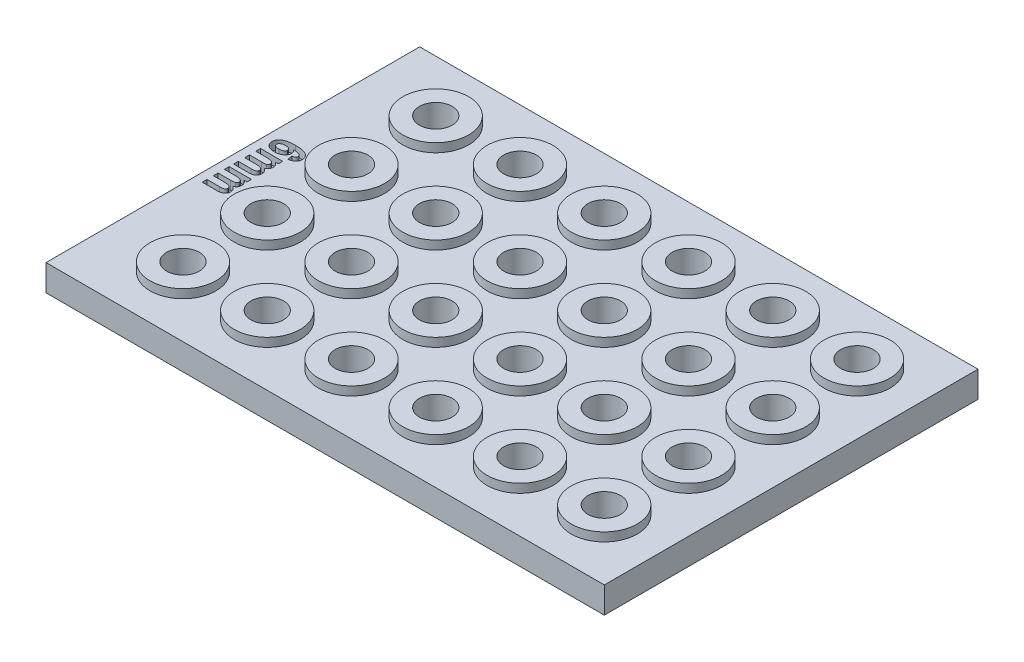
from build123d import *

# Parameters (mm, degrees)
SKETCH1_W            = 127.89
SKETCH1_H            = 85.6
MAIN_PLATE_DEPTH     = 6
WELLS_LSP_R          = 7.56
BOSS_EXTRUDE1_DEPTH  = 2
SKETCH2_W            = 3.75
SKETCH2_H            = 23.5
LPATTERN1_COUNT      = 4
LPATTERN1_PITCH      = 19.3
LPATTERN1_COUNT_DIR2 = 6
LPATTERN1_PITCH_DIR2 = 19.3
CUT_EXTRUDE1_DEPTH   = 2


with BuildPart() as part:
    # Sketch1 → Main Plate (new body)
    with BuildSketch(Plane(origin=(0, 0, 0), x_dir=(1, 0, 0), z_dir=(0, 1, 0))):
        Rectangle(SKETCH1_W, SKETCH1_H)
    extrude(amount=MAIN_PLATE_DEPTH)

    # Wells_LSP → Boss-Extrude1 (add)
    with BuildSketch(Plane(origin=(0, 6, 0), x_dir=(1, 0, 0), z_dir=(0, 1, 0))):
        with Locations(Location((-46.425, 28.96, 0), (0, 0, 270))):
            Circle(WELLS_LSP_R)
        with Locations(Location((-27.125, 28.96, 0), (0, 0, 270))):
            Circle(WELLS_LSP_R)
        with Locations(Location((-7.825, 28.96, 0), (0, 0, 270))):
            Circle(WELLS_LSP_R)
        with Locations(Location((11.475, 28.96, 0), (0, 0, 270))):
            Circle(WELLS_LSP_R)
        with Locations(Location((30.775, 28.96, 0), (0, 0, 270))):
            Circle(WELLS_LSP_R)
        with Locations(Location((50.075, 28.96, 0), (0, 0, 270))):
            Circle(WELLS_LSP_R)
        with Locations(Location((-27.125, 9.66, 0), (0, 0, 270))):
            Circle(WELLS_LSP_R)
        with Locations(Location((-7.825, 9.66, 0), (0, 0, 270))):
            Circle(WELLS_LSP_R)
        with Locations(Location((11.475, 9.66, 0), (0, 0, 270))):
            Circle(WELLS_LSP_R)
        with Locations(Location((30.775, 9.66, 0), (0, 0, 270))):
            Circle(WELLS_LSP_R)
        with Locations(Location((50.075, 9.66, 0), (0, 0, 270))):
            Circle(WELLS_LSP_R)
        with Locations(Location((-27.125, -9.64, 0), (0, 0, 270))):
            Circle(WELLS_LSP_R)
        with Locations(Location((-7.825, -9.64, 0), (0, 0, 270))):
            Circle(WELLS_LSP_R)
        with Locations(Location((11.475, -9.64, 0), (0, 0, 270))):
            Circle(WELLS_LSP_R)
        with Locations(Location((30.775, -9.64, 0), (0, 0, 270))):
            Circle(WELLS_LSP_R)
        with Locations(Location((50.075, -9.64, 0), (0, 0, 270))):
            Circle(WELLS_LSP_R)
        with Locations(Location((-27.125, -28.94, 0), (0, 0, 270))):
            Circle(WELLS_LSP_R)
        with Locations(Location((-7.825, -28.94, 0), (0, 0, 270))):
            Circle(WELLS_LSP_R)
        with Locations(Location((11.475, -28.94, 0), (0, 0, 270))):
            Circle(WELLS_LSP_R)
        with Locations(Location((30.775, -28.94, 0), (0, 0, 270))):
            Circle(WELLS_LSP_R)
        with Locations(Location((50.075, -28.94, 0), (0, 0, 270))):
            Circle(WELLS_LSP_R)
        with Locations(Location((-46.425, 9.66, 0), (0, 0, 270))):
            Circle(WELLS_LSP_R)
        with Locations(Location((-46.425, -9.64, 0), (0, 0, 270))):
            Circle(WELLS_LSP_R)
        with Locations(Location((-46.425, -28.94, 0), (0, 0, 270))):
            Circle(WELLS_LSP_R)
    extrude(amount=BOSS_EXTRUDE1_DEPTH)

    # Sketch2 → Cut-Revolve1 (revolve, cut)
    with BuildSketch(Plane(origin=(0, 0, -28.96), x_dir=(-1, 0, 0), z_dir=(0, 0, -1)), mode=Mode.PRIVATE) as cut_revolve1_sk:
        with Locations((48.3, 11.75)):
            Rectangle(SKETCH2_W, SKETCH2_H)
    cut_revolve1 = revolve(cut_revolve1_sk.sketch.rotate(Axis((-46.425, 23.5, -28.96), (0, -1, 0)), 270), axis=Axis((-46.425, 23.5, -28.96), (0, -1, 0)), mode=Mode.SUBTRACT)

    # LPattern1: Cut-Revolve1 4 × 6
    with Locations(*[(j * LPATTERN1_PITCH_DIR2, 0, i * LPATTERN1_PITCH) for i in range(LPATTERN1_COUNT) for j in range(LPATTERN1_COUNT_DIR2) if (i, j) != (0, 0)]):
        add(cut_revolve1, mode=Mode.SUBTRACT)

    # Sketch3 → Cut-Extrude1 (cut)
    # profile 1 of 3: a face of its own
    with BuildSketch(Plane(origin=(0, 6, 0), x_dir=(1, 0, 0), z_dir=(0, 1, 0))):
        with BuildLine():
            Line((-56.731072257, 5.409090909), (-56.912890439, 6.5))
            add(Edge.make_bspline(
                [(-56.912890439, 6.5), (-56.848754865, 6.507160681), (-56.72796693, 6.520646549), (-56.56047781, 6.560192719), (-56.417656996, 6.613160299), (-56.300493906, 6.681573851), (-56.206765303, 6.763700377), (-56.141754586, 6.862980945), (-56.100987931, 6.976613067), (-56.096857287, 7.057405463), (-56.094708621, 7.099431818)],
                knots=[0, 0, 0, 0, 1.373534822, 2.586808301, 3.656255023, 4.605807111, 5.462623692, 6.284975384, 7.107883449, 8, 8, 8, 8], degree=3))
            add(Edge.make_bspline(
                [(-56.094708621, 7.099431818), (-56.095617152, 7.127486244), (-56.097408923, 7.18281407), (-56.117301088, 7.263553824), (-56.147140948, 7.34126874), (-56.189734876, 7.415524739), (-56.246836807, 7.483977735), (-56.314059868, 7.549523281), (-56.392663465, 7.612385605), (-56.485461687, 7.67187712), (-56.597314698, 7.726246312), (-56.731646277, 7.776225511), (-56.891730839, 7.816390269), (-57.075059429, 7.857623835), (-57.284612512, 7.888333403), (-57.518502347, 7.917051654), (-57.77720298, 7.939497691), (-57.957838828, 7.949385812), (-58.052094984, 7.954545455)],
                knots=[0, 0, 0, 0, 0.576990169, 1.137917149, 1.703239646, 2.288990578, 2.892433666, 3.534106501, 4.221341408, 4.962944926, 5.800749476, 6.77943051, 7.910748907, 9.198722595, 10.650465757, 12.272170328, 14.054810806, 16, 16, 16, 16], degree=3))
            add(Edge.make_bspline(
                [(-58.052094984, 7.954545455), (-58.005002948, 7.920874283), (-57.913712886, 7.855601181), (-57.792238573, 7.746000091), (-57.690442226, 7.629665314), (-57.605547706, 7.508702989), (-57.53924654, 7.38081576), (-57.491647259, 7.246163833), (-57.464674452, 7.104288993), (-57.460471498, 7.007684503), (-57.458344984, 6.958806818)],
                knots=[0, 0, 0, 0, 1.147521788, 2.224523334, 3.235995272, 4.207625523, 5.148408325, 6.08392744, 7.030550333, 8, 8, 8, 8], degree=3))
            add(Edge.make_bspline(
                [(-57.458344984, 6.958806818), (-57.460412211, 6.904728745), (-57.464520831, 6.797248392), (-57.492697332, 6.638696267), (-57.544105098, 6.486681662), (-57.612453787, 6.33899984), (-57.701451843, 6.197023992), (-57.808644904, 6.059093953), (-57.937669904, 5.929151752), (-58.083234605, 5.804786957), (-58.24429731, 5.689401328), (-58.420957602, 5.590451057), (-58.609933186, 5.506547816), (-58.810950069, 5.435883274), (-59.025927754, 5.384794279), (-59.253192528, 5.3464532), (-59.492820713, 5.321308679), (-59.657144282, 5.319238462), (-59.741015439, 5.318181818)],
                knots=[0, 0, 0, 0, 0.832283334, 1.654165928, 2.467606077, 3.295667843, 4.153060879, 5.040790556, 5.978637068, 6.965831481, 7.9848927, 9.022517391, 10.076113705, 11.163856565, 12.296745883, 13.471966313, 14.709685334, 16, 16, 16, 16], degree=3))
            add(Edge.make_bspline(
                [(-59.741015439, 5.318181818), (-59.830565427, 5.31981348), (-60.004794602, 5.322988053), (-60.258196644, 5.347676619), (-60.496907246, 5.386341415), (-60.720148781, 5.444192474), (-60.930961408, 5.513694931), (-61.125085895, 5.604305967), (-61.30620481, 5.707412655), (-61.468716068, 5.828765441), (-61.615070473, 5.960616683), (-61.744023821, 6.101270151), (-61.851943404, 6.250880914), (-61.941618037, 6.407083543), (-62.010385331, 6.571732), (-62.057955865, 6.744598044), (-62.089312801, 6.924531496), (-62.092894113, 7.047215781), (-62.094708621, 7.109375)],
                knots=[0, 0, 0, 0, 1.298090761, 2.525575823, 3.687990512, 4.800185422, 5.866079674, 6.901223397, 7.900863476, 8.882546267, 9.835189119, 10.753655296, 11.643454654, 12.50428952, 13.359742743, 14.222546109, 15.099435223, 16, 16, 16, 16], degree=3))
            add(Edge.make_bspline(
                [(-62.094708621, 7.109375), (-62.092355706, 7.177751283), (-62.087709636, 7.312767216), (-62.047658363, 7.509895705), (-61.985107704, 7.69903181), (-61.894942389, 7.877947699), (-61.779159945, 8.048157571), (-61.637899626, 8.208331205), (-61.471164044, 8.359512428), (-61.2798247, 8.502789588), (-61.058407287, 8.633216921), (-60.802412506, 8.742706213), (-60.51510079, 8.83799263), (-60.193404811, 8.912896727), (-59.839709408, 8.974216114), (-59.452037759, 9.015238221), (-59.031616973, 9.04106282), (-58.740109861, 9.043955381), (-58.589026803, 9.045454545)],
                knots=[0, 0, 0, 0, 0.734880277, 1.451095922, 2.154962096, 2.872480545, 3.598606755, 4.363803828, 5.164164342, 6.015782743, 6.931263278, 7.921113567, 9.005098047, 10.183655502, 11.470683431, 12.864488494, 14.374919009, 16, 16, 16, 16], degree=3))
            add(Edge.make_bspline(
                [(-58.589026803, 9.045454545), (-58.43557853, 9.044027963), (-58.139315681, 9.041273657), (-57.711647607, 9.014426678), (-57.317214147, 8.969178262), (-56.956173486, 8.908526951), (-56.628724881, 8.827098569), (-56.333771407, 8.730639856), (-56.071516676, 8.614964859), (-55.844259718, 8.47852728), (-55.646305545, 8.329709141), (-55.474861746, 8.170185793), (-55.328465878, 8.000793193), (-55.20917469, 7.820506901), (-55.117428214, 7.629637704), (-55.051780175, 7.428641839), (-55.010475805, 7.217124054), (-55.006047326, 7.072160025), (-55.00379953, 6.998579545)],
                knots=[0, 0, 0, 0, 1.596518637, 3.082401342, 4.456168422, 5.726182561, 6.888816875, 7.96380488, 8.951761247, 9.864275317, 10.715608241, 11.524304739, 12.296474716, 13.039816174, 13.766981747, 14.492994826, 15.235078085, 16, 16, 16, 16], degree=3))
            add(Edge.make_bspline(
                [(-55.00379953, 6.998579545), (-55.005223128, 6.94784932), (-55.008028199, 6.847890011), (-55.028407362, 6.701415587), (-55.060775913, 6.560833788), (-55.107951567, 6.426497158), (-55.169564004, 6.298292291), (-55.243905361, 6.17568932), (-55.330517184, 6.058327754), (-55.432363082, 5.949358423), (-55.545310093, 5.845938859), (-55.675155305, 5.755330491), (-55.817070682, 5.672755301), (-55.973367838, 5.600613603), (-56.142390957, 5.535952149), (-56.326804585, 5.484763927), (-56.523867752, 5.439940506), (-56.660829985, 5.419548914), (-56.731072257, 5.409090909)],
                knots=[0, 0, 0, 0, 0.938429574, 1.849090387, 2.730978085, 3.6037676, 4.477611741, 5.358062252, 6.253423895, 7.171011581, 8.113928736, 9.081433186, 10.094207076, 11.148493307, 12.263080455, 13.438792911, 14.68646268, 16, 16, 16, 16], degree=3))
        make_face()
        with BuildLine():
            add(Edge.make_bspline(
                [(-59.696981348, 7.863636364), (-59.748127116, 7.862587002), (-59.847672167, 7.860544628), (-59.992921278, 7.85140129), (-60.128559191, 7.832839308), (-60.255510601, 7.807579073), (-60.372063674, 7.773435818), (-60.48052111, 7.734044083), (-60.578709107, 7.685309204), (-60.667637214, 7.630577475), (-60.746137919, 7.570507377), (-60.81429385, 7.507964872), (-60.873199153, 7.444436919), (-60.920760521, 7.378067894), (-60.95861683, 7.30973833), (-60.98373951, 7.238065824), (-61.000264259, 7.165043372), (-61.002621251, 7.115617491), (-61.00379953, 7.090909091)],
                knots=[0, 0, 0, 0, 1.467063455, 2.855346856, 4.170798216, 5.390463327, 6.563664699, 7.650722887, 8.695222878, 9.701329085, 10.641009281, 11.525189072, 12.351817551, 13.120543733, 13.861795579, 14.583384742, 15.291822527, 16, 16, 16, 16], degree=3))
            add(Edge.make_bspline(
                [(-61.00379953, 7.090909091), (-61.000812455, 7.043490184), (-60.994910668, 6.949801096), (-60.938172322, 6.817544172), (-60.84787632, 6.699662928), (-60.746944467, 6.61477858), (-60.64874761, 6.555575885), (-60.561687574, 6.515609012), (-60.462580335, 6.484032699), (-60.353777784, 6.455177199), (-60.233562134, 6.434029549), (-60.102485264, 6.421084341), (-59.960420911, 6.410009132), (-59.861779438, 6.409404506), (-59.810617712, 6.409090909)],
                knots=[0, 0, 0, 0, 1.10939644, 2.191917695, 3.319954251, 4.574866243, 5.263603829, 6.010279106, 6.819397753, 7.704415383, 8.653663817, 9.683155171, 10.79833729, 12, 12, 12, 12], degree=3))
            add(Edge.make_bspline(
                [(-59.810617712, 6.409090909), (-59.757572846, 6.409499865), (-59.655168457, 6.410289366), (-59.507186172, 6.420138638), (-59.370702758, 6.437339933), (-59.24477008, 6.459485836), (-59.130338198, 6.489059333), (-59.026558827, 6.524618704), (-58.933705793, 6.566661833), (-58.82907327, 6.63173091), (-58.718746611, 6.722065713), (-58.620855218, 6.848961661), (-58.559017272, 6.990535965), (-58.552527053, 7.090309715), (-58.549254075, 7.140625)],
                knots=[0, 0, 0, 0, 1.176453253, 2.271171319, 3.287245332, 4.22660609, 5.105423138, 5.905880325, 6.657735779, 7.360218118, 8.634991581, 9.796584371, 10.888831116, 12, 12, 12, 12], degree=3))
            add(Edge.make_bspline(
                [(-58.549254075, 7.140625), (-58.552842269, 7.189435193), (-58.560000965, 7.286814927), (-58.617463204, 7.425459416), (-58.710601568, 7.550774294), (-58.815405868, 7.64055417), (-58.914496211, 7.705358518), (-59.000396242, 7.747993073), (-59.094908405, 7.783006674), (-59.197716293, 7.813449089), (-59.310080562, 7.835157609), (-59.430902832, 7.852520314), (-59.560924523, 7.862443416), (-59.650563327, 7.86322937), (-59.696981348, 7.863636364)],
                knots=[0, 0, 0, 0, 1.160949793, 2.316175707, 3.519822443, 4.855974483, 5.582526876, 6.339918642, 7.136761333, 7.98355107, 8.893612599, 9.862824193, 10.893297682, 12, 12, 12, 12], degree=3))
        make_face(mode=Mode.SUBTRACT)
    # profile 2 of 3: a face of its own
    with BuildSketch(Plane(origin=(0, 6, 0), x_dir=(1, 0, 0), z_dir=(0, 1, 0))):
        with BuildLine():
            Line((-56.912890439, 4.409090909), (-56.912890439, 3.409090909))
            Line((-56.912890439, 3.409090909), (-57.607492712, 3.409090909))
            add(Edge.make_bspline(
                [(-57.607492712, 3.409090909), (-57.543116398, 3.362940642), (-57.419041386, 3.273993412), (-57.254299345, 3.125793027), (-57.117584129, 2.970014214), (-57.008528907, 2.806941178), (-56.925172299, 2.637085904), (-56.864881169, 2.461158463), (-56.828116844, 2.278044496), (-56.824035958, 2.15357562), (-56.821981348, 2.090909091)],
                knots=[0, 0, 0, 0, 1.18585077, 2.285537003, 3.311018897, 4.282753788, 5.215288273, 6.137107824, 7.062086912, 8, 8, 8, 8], degree=3))
            add(Edge.make_bspline(
                [(-56.821981348, 2.090909091), (-56.824457113, 2.024936578), (-56.829271835, 1.896637083), (-56.866122467, 1.71071691), (-56.93152536, 1.539805345), (-57.019814098, 1.381286333), (-57.135925839, 1.238358128), (-57.275321541, 1.106955031), (-57.442789975, 0.992135756), (-57.567370087, 0.929856749), (-57.631640439, 0.897727273)],
                knots=[0, 0, 0, 0, 1.032363716, 2.007680752, 2.950610311, 3.886464362, 4.835606831, 5.82137184, 6.876054961, 8, 8, 8, 8], degree=3))
            add(Edge.make_bspline(
                [(-57.631640439, 0.897727273), (-57.567443193, 0.850886136), (-57.443356463, 0.760346996), (-57.275905299, 0.61337145), (-57.13683566, 0.458115544), (-57.021884033, 0.299080188), (-56.93310729, 0.1341301), (-56.867121725, -0.035203134), (-56.82982347, -0.211443732), (-56.824599555, -0.330802709), (-56.821981348, -0.390625)],
                knots=[0, 0, 0, 0, 1.202740909, 2.324775499, 3.365275479, 4.351815561, 5.288261977, 6.19346422, 7.094570761, 8, 8, 8, 8], degree=3))
            add(Edge.make_bspline(
                [(-56.821981348, -0.390625), (-56.824207442, -0.460437099), (-56.828529321, -0.595974729), (-56.868625347, -0.791296276), (-56.929984495, -0.972812634), (-57.020917622, -1.137029541), (-57.13434081, -1.284483766), (-57.268698999, -1.415723738), (-57.427501524, -1.524936876), (-57.575531863, -1.601250693), (-57.707853903, -1.651548554), (-57.821353993, -1.684386557), (-57.947390863, -1.710305983), (-58.08621279, -1.733212916), (-58.237366456, -1.751497348), (-58.401811878, -1.764168754), (-58.578554746, -1.770807133), (-58.700764209, -1.772074274), (-58.763742712, -1.772727273)],
                knots=[0, 0, 0, 0, 1.23071008, 2.389378461, 3.50465438, 4.600411856, 5.685152553, 6.778453708, 7.900502651, 9.074022523, 9.708788861, 10.396364239, 11.156854391, 11.978390981, 12.879114841, 13.843054262, 14.888455842, 16, 16, 16, 16], degree=3))
            Line((-58.763742712, -1.772727273), (-62.00379953, -1.772727273))
            Line((-62.00379953, -1.772727273), (-62.00379953, -0.681818182))
            Line((-62.00379953, -0.681818182), (-59.089026803, -0.681818182))
            add(Edge.make_bspline(
                [(-59.089026803, -0.681818182), (-59.027945769, -0.681039532), (-58.911439952, -0.679554336), (-58.744630091, -0.674796867), (-58.59394238, -0.663439588), (-58.459033731, -0.647439937), (-58.339573268, -0.630526452), (-58.236644789, -0.606108312), (-58.149294781, -0.578409915), (-58.056028768, -0.536146763), (-57.960562024, -0.467806945), (-57.877817638, -0.358557414), (-57.829381142, -0.22438115), (-57.824540782, -0.127782788), (-57.821981348, -0.076704545)],
                knots=[0, 0, 0, 0, 1.383466805, 2.638821246, 3.778719439, 4.804235443, 5.715712558, 6.509016418, 7.19739627, 7.787565388, 8.823512243, 9.818640032, 10.846563945, 12, 12, 12, 12], degree=3))
            add(Edge.make_bspline(
                [(-57.821981348, -0.076704545), (-57.822972553, -0.045360845), (-57.824910433, 0.015918443), (-57.843092559, 0.104990587), (-57.869744958, 0.18975185), (-57.908276808, 0.269787527), (-57.959001931, 0.344432223), (-58.020635476, 0.414490851), (-58.093714412, 0.479402372), (-58.17718828, 0.542034202), (-58.277389565, 0.599267184), (-58.399429541, 0.643722371), (-58.540446241, 0.685837849), (-58.703286829, 0.717106342), (-58.886315969, 0.742245613), (-59.09058563, 0.76085645), (-59.315748061, 0.769676096), (-59.473017402, 0.771682287), (-59.554935894, 0.772727273)],
                knots=[0, 0, 0, 0, 0.69688417, 1.362460852, 2.015740612, 2.670972873, 3.33160781, 4.018699962, 4.7425581, 5.50352258, 6.338874527, 7.299879275, 8.387136119, 9.612850157, 10.985619131, 12.498984496, 14.17639021, 16, 16, 16, 16], degree=3))
            Line((-59.554935894, 0.772727273), (-62.00379953, 0.772727273))
            Line((-62.00379953, 0.772727273), (-62.00379953, 1.863636364))
            Line((-62.00379953, 1.863636364), (-59.209765439, 1.863636364))
            add(Edge.make_bspline(
                [(-59.209765439, 1.863636364), (-59.143473891, 1.863866243), (-59.017031197, 1.864304709), (-58.837087778, 1.868713837), (-58.675495629, 1.874924419), (-58.532557866, 1.886938817), (-58.40740602, 1.899119477), (-58.300911121, 1.913658152), (-58.213193605, 1.933521071), (-58.161854634, 1.949977819), (-58.138742712, 1.957386364)],
                knots=[0, 0, 0, 0, 1.474579857, 2.812573463, 4.003904225, 5.071012922, 6.002702754, 6.801087064, 7.460270018, 8, 8, 8, 8], degree=3))
            add(Edge.make_bspline(
                [(-58.138742712, 1.957386364), (-58.113795863, 1.968590631), (-58.06510389, 1.990459441), (-57.999503471, 2.032911442), (-57.943869558, 2.083553968), (-57.899592961, 2.143249288), (-57.863377159, 2.209897737), (-57.840076596, 2.285753275), (-57.823382848, 2.368111025), (-57.822458701, 2.426042433), (-57.821981348, 2.455965909)],
                knots=[0, 0, 0, 0, 1.035565722, 2.02124684, 2.948493026, 3.87103721, 4.82651521, 5.808430736, 6.867982454, 8, 8, 8, 8], degree=3))
            add(Edge.make_bspline(
                [(-57.821981348, 2.455965909), (-57.823701941, 2.497377817), (-57.827115234, 2.579530274), (-57.860608439, 2.699415403), (-57.912047914, 2.814038159), (-57.983423142, 2.922399225), (-58.074716306, 3.021360592), (-58.187387882, 3.105302799), (-58.318003314, 3.175131756), (-58.44121022, 3.220172751), (-58.553547007, 3.247222451), (-58.652367128, 3.267678022), (-58.765040117, 3.281822012), (-58.890808012, 3.297237974), (-59.030711048, 3.306010996), (-59.184132004, 3.313235402), (-59.350841496, 3.317437412), (-59.466392195, 3.317927018), (-59.526526803, 3.318181818)],
                knots=[0, 0, 0, 0, 0.924341018, 1.833696853, 2.762757941, 3.72619197, 4.72287041, 5.758618708, 6.853174813, 8.025793947, 8.680773075, 9.436781179, 10.281493003, 11.21944483, 12.270510512, 13.415497155, 14.654979434, 16, 16, 16, 16], degree=3))
            Line((-59.526526803, 3.318181818), (-62.00379953, 3.318181818))
            Line((-62.00379953, 3.318181818), (-62.00379953, 4.409090909))
            Line((-62.00379953, 4.409090909), (-56.912890439, 4.409090909))
        make_face()
    # profile 3 of 3: a face of its own
    with BuildSketch(Plane(origin=(0, 6, 0), x_dir=(1, 0, 0), z_dir=(0, 1, 0))):
        with BuildLine():
            Line((-56.912890439, -2.772727273), (-56.912890439, -3.772727273))
            Line((-56.912890439, -3.772727273), (-57.607492712, -3.772727273))
            add(Edge.make_bspline(
                [(-57.607492712, -3.772727273), (-57.543116398, -3.818877539), (-57.419041386, -3.90782477), (-57.254299345, -4.056025155), (-57.117584129, -4.211803968), (-57.008528907, -4.374877003), (-56.925172299, -4.544732278), (-56.864881169, -4.720659719), (-56.828116844, -4.903773686), (-56.824035958, -5.028242562), (-56.821981348, -5.090909091)],
                knots=[0, 0, 0, 0, 1.18585077, 2.285537003, 3.311018897, 4.282753788, 5.215288273, 6.137107824, 7.062086912, 8, 8, 8, 8], degree=3))
            add(Edge.make_bspline(
                [(-56.821981348, -5.090909091), (-56.824457113, -5.156881603), (-56.829271835, -5.285181098), (-56.866122467, -5.471101271), (-56.93152536, -5.642012837), (-57.019814098, -5.800531848), (-57.135925839, -5.943460054), (-57.275321541, -6.074863151), (-57.442789975, -6.189682426), (-57.567370087, -6.251961433), (-57.631640439, -6.284090909)],
                knots=[0, 0, 0, 0, 1.032363716, 2.007680752, 2.950610311, 3.886464362, 4.835606831, 5.82137184, 6.876054961, 8, 8, 8, 8], degree=3))
            add(Edge.make_bspline(
                [(-57.631640439, -6.284090909), (-57.567443193, -6.330932046), (-57.443356463, -6.421471186), (-57.275905299, -6.568446731), (-57.13683566, -6.723702638), (-57.021884033, -6.882737993), (-56.93310729, -7.047688082), (-56.867121725, -7.217021316), (-56.82982347, -7.393261913), (-56.824599555, -7.512620891), (-56.821981348, -7.572443182)],
                knots=[0, 0, 0, 0, 1.202740909, 2.324775499, 3.365275479, 4.351815561, 5.288261977, 6.19346422, 7.094570761, 8, 8, 8, 8], degree=3))
            add(Edge.make_bspline(
                [(-56.821981348, -7.572443182), (-56.824207442, -7.642255281), (-56.828529321, -7.777792911), (-56.868625347, -7.973114458), (-56.929984495, -8.154630816), (-57.020917622, -8.318847723), (-57.13434081, -8.466301948), (-57.268698999, -8.59754192), (-57.427501524, -8.706755058), (-57.575531863, -8.783068875), (-57.707853903, -8.833366736), (-57.821353993, -8.866204739), (-57.947390863, -8.892124165), (-58.08621279, -8.915031098), (-58.237366456, -8.93331553), (-58.401811878, -8.945986936), (-58.578554746, -8.952625315), (-58.700764209, -8.953892456), (-58.763742712, -8.954545455)],
                knots=[0, 0, 0, 0, 1.23071008, 2.389378461, 3.50465438, 4.600411856, 5.685152553, 6.778453708, 7.900502651, 9.074022523, 9.708788861, 10.396364239, 11.156854391, 11.978390981, 12.879114841, 13.843054262, 14.888455842, 16, 16, 16, 16], degree=3))
            Line((-58.763742712, -8.954545455), (-62.00379953, -8.954545455))
            Line((-62.00379953, -8.954545455), (-62.00379953, -7.863636364))
            Line((-62.00379953, -7.863636364), (-59.089026803, -7.863636364))
            add(Edge.make_bspline(
                [(-59.089026803, -7.863636364), (-59.027945769, -7.862857714), (-58.911439952, -7.861372518), (-58.744630091, -7.856615049), (-58.59394238, -7.84525777), (-58.459033731, -7.829258119), (-58.339573268, -7.812344634), (-58.236644789, -7.787926494), (-58.149294781, -7.760228097), (-58.056028768, -7.717964945), (-57.960562024, -7.649625127), (-57.877817638, -7.540375596), (-57.829381142, -7.406199331), (-57.824540782, -7.30960097), (-57.821981348, -7.258522727)],
                knots=[0, 0, 0, 0, 1.383466805, 2.638821246, 3.778719439, 4.804235443, 5.715712558, 6.509016418, 7.19739627, 7.787565388, 8.823512243, 9.818640032, 10.846563945, 12, 12, 12, 12], degree=3))
            add(Edge.make_bspline(
                [(-57.821981348, -7.258522727), (-57.822972553, -7.227179027), (-57.824910433, -7.165899739), (-57.843092559, -7.076827594), (-57.869744958, -6.992066332), (-57.908276808, -6.912030655), (-57.959001931, -6.837385958), (-58.020635476, -6.76732733), (-58.093714412, -6.70241581), (-58.17718828, -6.63978398), (-58.277389565, -6.582550998), (-58.399429541, -6.538095811), (-58.540446241, -6.495980333), (-58.703286829, -6.46471184), (-58.886315969, -6.439572569), (-59.09058563, -6.420961732), (-59.315748061, -6.412142086), (-59.473017402, -6.410135894), (-59.554935894, -6.409090909)],
                knots=[0, 0, 0, 0, 0.69688417, 1.362460852, 2.015740612, 2.670972873, 3.33160781, 4.018699962, 4.7425581, 5.50352258, 6.338874527, 7.299879275, 8.387136119, 9.612850157, 10.985619131, 12.498984496, 14.17639021, 16, 16, 16, 16], degree=3))
            Line((-59.554935894, -6.409090909), (-62.00379953, -6.409090909))
            Line((-62.00379953, -6.409090909), (-62.00379953, -5.318181818))
            Line((-62.00379953, -5.318181818), (-59.209765439, -5.318181818))
            add(Edge.make_bspline(
                [(-59.209765439, -5.318181818), (-59.143473891, -5.317951939), (-59.017031197, -5.317513472), (-58.837087778, -5.313104345), (-58.675495629, -5.306893763), (-58.532557866, -5.294879364), (-58.40740602, -5.282698705), (-58.300911121, -5.26816003), (-58.213193605, -5.248297111), (-58.161854634, -5.231840363), (-58.138742712, -5.224431818)],
                knots=[0, 0, 0, 0, 1.474579857, 2.812573463, 4.003904225, 5.071012922, 6.002702754, 6.801087064, 7.460270018, 8, 8, 8, 8], degree=3))
            add(Edge.make_bspline(
                [(-58.138742712, -5.224431818), (-58.113795863, -5.213227551), (-58.06510389, -5.191358741), (-57.999503471, -5.14890674), (-57.943869558, -5.098264214), (-57.899592961, -5.038568893), (-57.863377159, -4.971920444), (-57.840076596, -4.896064907), (-57.823382848, -4.813707157), (-57.822458701, -4.755775749), (-57.821981348, -4.725852273)],
                knots=[0, 0, 0, 0, 1.035565722, 2.02124684, 2.948493026, 3.87103721, 4.82651521, 5.808430736, 6.867982454, 8, 8, 8, 8], degree=3))
            add(Edge.make_bspline(
                [(-57.821981348, -4.725852273), (-57.823701941, -4.684440365), (-57.827115234, -4.602287908), (-57.860608439, -4.482402779), (-57.912047914, -4.367780023), (-57.983423142, -4.259418957), (-58.074716306, -4.16045759), (-58.187387882, -4.076515383), (-58.318003314, -4.006686426), (-58.44121022, -3.96164543), (-58.553547007, -3.93459573), (-58.652367128, -3.914140159), (-58.765040117, -3.89999617), (-58.890808012, -3.884580208), (-59.030711048, -3.875807186), (-59.184132004, -3.868582779), (-59.350841496, -3.86438077), (-59.466392195, -3.863891163), (-59.526526803, -3.863636364)],
                knots=[0, 0, 0, 0, 0.924341018, 1.833696853, 2.762757941, 3.72619197, 4.72287041, 5.758618708, 6.853174813, 8.025793947, 8.680773075, 9.436781179, 10.281493003, 11.21944483, 12.270510512, 13.415497155, 14.654979434, 16, 16, 16, 16], degree=3))
            Line((-59.526526803, -3.863636364), (-62.00379953, -3.863636364))
            Line((-62.00379953, -3.863636364), (-62.00379953, -2.772727273))
            Line((-62.00379953, -2.772727273), (-56.912890439, -2.772727273))
        make_face()
    extrude(amount=-CUT_EXTRUDE1_DEPTH, mode=Mode.SUBTRACT)


solid = part.part
